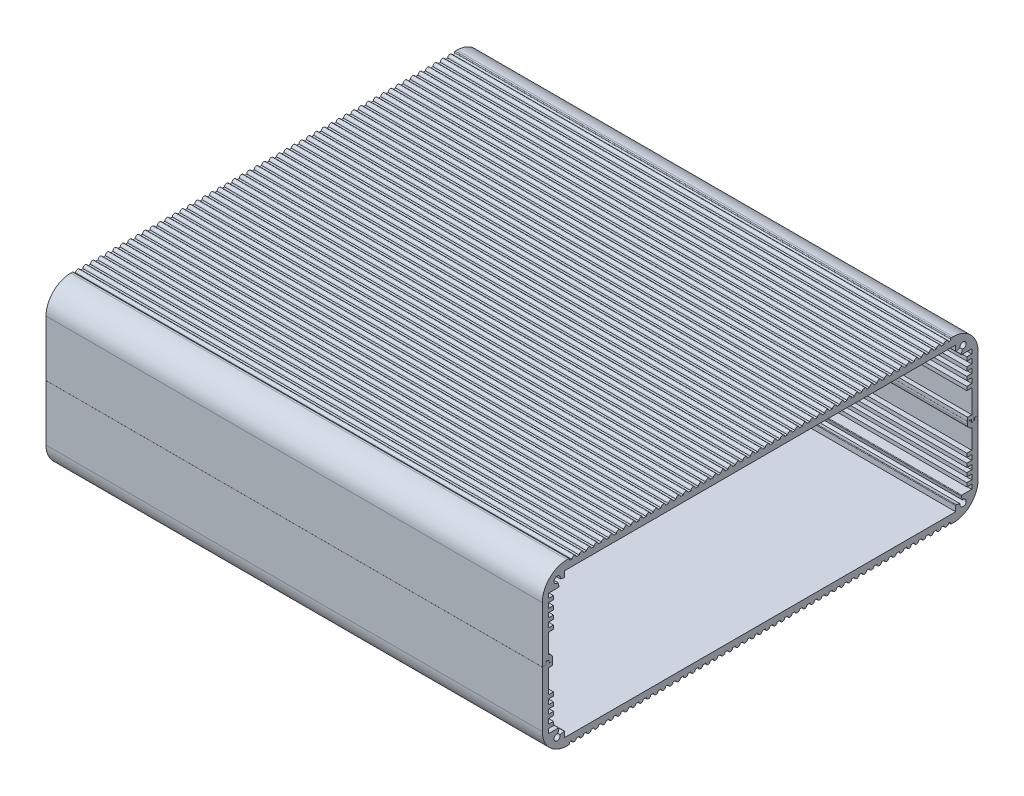
from build123d import *

# Parameters (mm, degrees)
EXTRUDE_1_DEPTH   = 100
EXTRUDE_1_2_DEPTH = 100


with BuildPart() as part:
    # 草图1 → 凸台-拉伸1 (new, symmetric)
    with BuildSketch(Plane(origin=(0, 0, 0), x_dir=(0, 0, -1), z_dir=(1, 0, 0))):
        with BuildLine():
            Line((-85.55, 1.21), (-85.85, 1.21))
            ThreePointArc((-85.85, 1.21), (-86.203553391, 1.063553391), (-86.35, 0.71))
            Line((-86.35, 0.71), (-86.35, 0.01))
            Line((-86.35, 0.01), (-87.8, 0.01))
            Line((-87.8, 0.01), (-87.8, 22.51))
            ThreePointArc((-87.8, 22.51), (-84.871067812, 29.581067812), (-77.8, 32.51))
            Line((-77.8, 32.51), (-77.1, 32.51))
            ThreePointArc((-77.1, 32.51), (-76.887867966, 32.422132034), (-76.8, 32.21))
            Line((-76.8, 32.21), (-76.8, 32.11))
            ThreePointArc((-76.8, 32.11), (-76.653553391, 31.756446609), (-76.3, 31.61))
            Line((-76.3, 31.61), (-75.9, 31.61))
            ThreePointArc((-75.9, 31.61), (-75, 32.51), (-74.1, 31.61))
            Line((-74.1, 31.61), (-72.9, 31.61))
            ThreePointArc((-72.9, 31.61), (-72, 32.51), (-71.1, 31.61))
            Line((-71.1, 31.61), (-69.9, 31.61))
            ThreePointArc((-69.9, 31.61), (-69, 32.51), (-68.1, 31.61))
            Line((-68.1, 31.61), (-66.9, 31.61))
            ThreePointArc((-66.9, 31.61), (-66, 32.51), (-65.1, 31.61))
            Line((-65.1, 31.61), (-63.9, 31.61))
            ThreePointArc((-63.9, 31.61), (-63, 32.51), (-62.1, 31.61))
            Line((-62.1, 31.61), (-60.9, 31.61))
            ThreePointArc((-60.9, 31.61), (-60, 32.51), (-59.1, 31.61))
            Line((-59.1, 31.61), (-57.9, 31.61))
            ThreePointArc((-57.9, 31.61), (-57, 32.51), (-56.1, 31.61))
            Line((-56.1, 31.61), (-54.9, 31.61))
            ThreePointArc((-54.9, 31.61), (-54, 32.51), (-53.1, 31.61))
            Line((-53.1, 31.61), (-51.9, 31.61))
            ThreePointArc((-51.9, 31.61), (-51, 32.51), (-50.1, 31.61))
            Line((-50.1, 31.61), (-48.9, 31.61))
            ThreePointArc((-48.9, 31.61), (-48, 32.51), (-47.1, 31.61))
            Line((-47.1, 31.61), (-45.9, 31.61))
            ThreePointArc((-45.9, 31.61), (-45, 32.51), (-44.1, 31.61))
            Line((-44.1, 31.61), (-42.9, 31.61))
            ThreePointArc((-42.9, 31.61), (-42, 32.51), (-41.1, 31.61))
            Line((-41.1, 31.61), (-39.9, 31.61))
            ThreePointArc((-39.9, 31.61), (-39, 32.51), (-38.1, 31.61))
            Line((-38.1, 31.61), (-36.9, 31.61))
            ThreePointArc((-36.9, 31.61), (-36, 32.51), (-35.1, 31.61))
            Line((-35.1, 31.61), (-33.9, 31.61))
            ThreePointArc((-33.9, 31.61), (-33, 32.51), (-32.1, 31.61))
            Line((-32.1, 31.61), (-30.9, 31.61))
            ThreePointArc((-30.9, 31.61), (-30, 32.51), (-29.1, 31.61))
            Line((-29.1, 31.61), (-27.9, 31.61))
            ThreePointArc((-27.9, 31.61), (-27, 32.51), (-26.1, 31.61))
            Line((-26.1, 31.61), (-24.9, 31.61))
            ThreePointArc((-24.9, 31.61), (-24, 32.51), (-23.1, 31.61))
            Line((-23.1, 31.61), (-21.9, 31.61))
            ThreePointArc((-21.9, 31.61), (-21, 32.51), (-20.1, 31.61))
            Line((-20.1, 31.61), (-18.9, 31.61))
            ThreePointArc((-18.9, 31.61), (-18, 32.51), (-17.1, 31.61))
            Line((-17.1, 31.61), (-15.9, 31.61))
            ThreePointArc((-15.9, 31.61), (-15, 32.51), (-14.1, 31.61))
            Line((-14.1, 31.61), (-12.9, 31.61))
            ThreePointArc((-12.9, 31.61), (-12, 32.51), (-11.1, 31.61))
            Line((-11.1, 31.61), (-9.9, 31.61))
            ThreePointArc((-9.9, 31.61), (-9, 32.51), (-8.1, 31.61))
            Line((-8.1, 31.61), (-6.9, 31.61))
            ThreePointArc((-6.9, 31.61), (-6, 32.51), (-5.1, 31.61))
            Line((-5.1, 31.61), (-3.9, 31.61))
            ThreePointArc((-3.9, 31.61), (-3, 32.51), (-2.1, 31.61))
            Line((-2.1, 31.61), (-0.9, 31.61))
            ThreePointArc((-0.9, 31.61), (0, 32.51), (0.9, 31.61))
            Line((0.9, 31.61), (2.1, 31.61))
            ThreePointArc((2.1, 31.61), (3, 32.51), (3.9, 31.61))
            Line((3.9, 31.61), (5.1, 31.61))
            ThreePointArc((5.1, 31.61), (6, 32.51), (6.9, 31.61))
            Line((6.9, 31.61), (8.1, 31.61))
            ThreePointArc((8.1, 31.61), (9, 32.51), (9.9, 31.61))
            Line((9.9, 31.61), (11.1, 31.61))
            ThreePointArc((11.1, 31.61), (12, 32.51), (12.9, 31.61))
            Line((12.9, 31.61), (14.1, 31.61))
            ThreePointArc((14.1, 31.61), (15, 32.51), (15.9, 31.61))
            Line((15.9, 31.61), (17.1, 31.61))
            ThreePointArc((17.1, 31.61), (18, 32.51), (18.9, 31.61))
            Line((18.9, 31.61), (20.1, 31.61))
            ThreePointArc((20.1, 31.61), (21, 32.51), (21.9, 31.61))
            Line((21.9, 31.61), (23.1, 31.61))
            ThreePointArc((23.1, 31.61), (24, 32.51), (24.9, 31.61))
            Line((24.9, 31.61), (26.1, 31.61))
            ThreePointArc((26.1, 31.61), (27, 32.51), (27.9, 31.61))
            Line((27.9, 31.61), (29.1, 31.61))
            ThreePointArc((29.1, 31.61), (30, 32.51), (30.9, 31.61))
            Line((30.9, 31.61), (32.1, 31.61))
            ThreePointArc((32.1, 31.61), (33, 32.51), (33.9, 31.61))
            Line((33.9, 31.61), (35.1, 31.61))
            ThreePointArc((35.1, 31.61), (36, 32.51), (36.9, 31.61))
            Line((36.9, 31.61), (38.1, 31.61))
            ThreePointArc((38.1, 31.61), (39, 32.51), (39.9, 31.61))
            Line((39.9, 31.61), (41.1, 31.61))
            ThreePointArc((41.1, 31.61), (42, 32.51), (42.9, 31.61))
            Line((42.9, 31.61), (44.1, 31.61))
            ThreePointArc((44.1, 31.61), (45, 32.51), (45.9, 31.61))
            Line((45.9, 31.61), (47.1, 31.61))
            ThreePointArc((47.1, 31.61), (48, 32.51), (48.9, 31.61))
            Line((48.9, 31.61), (50.1, 31.61))
            ThreePointArc((50.1, 31.61), (51, 32.51), (51.9, 31.61))
            Line((51.9, 31.61), (53.1, 31.61))
            ThreePointArc((53.1, 31.61), (54, 32.51), (54.9, 31.61))
            Line((54.9, 31.61), (56.1, 31.61))
            ThreePointArc((56.1, 31.61), (57, 32.51), (57.9, 31.61))
            Line((57.9, 31.61), (59.1, 31.61))
            ThreePointArc((59.1, 31.61), (60, 32.51), (60.9, 31.61))
            Line((60.9, 31.61), (62.1, 31.61))
            ThreePointArc((62.1, 31.61), (63, 32.51), (63.9, 31.61))
            Line((63.9, 31.61), (65.1, 31.61))
            ThreePointArc((65.1, 31.61), (66, 32.51), (66.9, 31.61))
            Line((66.9, 31.61), (68.1, 31.61))
            ThreePointArc((68.1, 31.61), (69, 32.51), (69.9, 31.61))
            Line((69.9, 31.61), (71.1, 31.61))
            ThreePointArc((71.1, 31.61), (72, 32.51), (72.9, 31.61))
            Line((72.9, 31.61), (74.1, 31.61))
            ThreePointArc((74.1, 31.61), (75, 32.51), (75.9, 31.61))
            Line((75.9, 31.61), (76.3, 31.61))
            ThreePointArc((76.3, 31.61), (76.653553391, 31.756446609), (76.8, 32.11))
            Line((76.8, 32.11), (76.8, 32.21))
            ThreePointArc((76.8, 32.21), (76.887867966, 32.422132034), (77.1, 32.51))
            Line((77.1, 32.51), (77.8, 32.51))
            ThreePointArc((77.8, 32.51), (84.871067812, 29.581067812), (87.8, 22.51))
            Line((87.8, 22.51), (87.8, 0.01))
            Line((87.8, 0.01), (86.25, 0.01))
            Line((86.25, 0.01), (86.25, -0.69))
            ThreePointArc((86.25, -0.69), (86.103553391, -1.043553391), (85.75, -1.19))
            Line((85.75, -1.19), (85.65, -1.19))
            ThreePointArc((85.65, -1.19), (85.296446609, -1.043553391), (85.15, -0.69))
            Line((85.15, -0.69), (85.15, 0.01))
            Line((85.15, 0.01), (83.6, 0.01))
            Line((83.6, 0.01), (83.6, 1.51))
            Line((83.6, 1.51), (85.3, 1.51))
            Line((85.3, 1.51), (85.3, 10.91))
            Line((85.3, 10.91), (83.3, 10.91))
            Line((83.3, 10.91), (83.3, 12.41))
            Line((83.3, 12.41), (85.3, 12.41))
            Line((85.3, 12.41), (85.3, 14.41))
            Line((85.3, 14.41), (83.3, 14.41))
            Line((83.3, 14.41), (83.3, 15.91))
            Line((83.3, 15.91), (85.3, 15.91))
            Line((85.3, 15.91), (85.3, 17.71))
            Line((85.3, 17.71), (83.3, 17.71))
            Line((83.3, 17.71), (83.3, 19.21))
            Line((83.3, 19.21), (85.3, 19.21))
            Line((85.3, 19.21), (85.3, 21.21))
            Line((85.3, 21.21), (83.3, 21.21))
            Line((83.3, 21.21), (83.3, 22.71))
            Line((83.3, 22.71), (85.3, 22.71))
            Line((85.3, 22.71), (85.3, 24.51))
            Line((85.3, 24.51), (81.256797497, 24.51))
            ThreePointArc((81.256797497, 24.51), (81.098126829, 24.588247714), (81.063612332, 24.761763809))
            Line((81.063612332, 24.761763809), (81.476476194, 26.302592717))
            ThreePointArc((81.476476194, 26.302592717), (82.683883476, 28.393883476), (80.592592717, 27.186476194))
            Line((80.592592717, 27.186476194), (79.051763809, 26.773612332))
            ThreePointArc((79.051763809, 26.773612332), (78.878247714, 26.808126829), (78.8, 26.966797497))
            Line((78.8, 26.966797497), (78.8, 29.11))
            Line((78.8, 29.11), (-78.8, 29.11))
            Line((-78.8, 29.11), (-78.8, 26.966797497))
            ThreePointArc((-78.8, 26.966797497), (-78.878247714, 26.808126829), (-79.051763809, 26.773612332))
            Line((-79.051763809, 26.773612332), (-80.592592717, 27.186476194))
            ThreePointArc((-80.592592717, 27.186476194), (-82.683883476, 28.393883476), (-81.476476194, 26.302592717))
            Line((-81.476476194, 26.302592717), (-81.063612332, 24.761763809))
            ThreePointArc((-81.063612332, 24.761763809), (-81.098126829, 24.588247714), (-81.256797497, 24.51))
            Line((-81.256797497, 24.51), (-85.3, 24.51))
            Line((-85.3, 24.51), (-85.3, 22.71))
            Line((-85.3, 22.71), (-83.3, 22.71))
            Line((-83.3, 22.71), (-83.3, 21.21))
            Line((-83.3, 21.21), (-85.3, 21.21))
            Line((-85.3, 21.21), (-85.3, 19.21))
            Line((-85.3, 19.21), (-83.3, 19.21))
            Line((-83.3, 19.21), (-83.3, 17.71))
            Line((-83.3, 17.71), (-85.3, 17.71))
            Line((-85.3, 17.71), (-85.3, 15.91))
            Line((-85.3, 15.91), (-83.3, 15.91))
            Line((-83.3, 15.91), (-83.3, 14.41))
            Line((-83.3, 14.41), (-85.3, 14.41))
            Line((-85.3, 14.41), (-85.3, 12.41))
            Line((-85.3, 12.41), (-83.3, 12.41))
            Line((-83.3, 12.41), (-83.3, 10.91))
            Line((-83.3, 10.91), (-85.3, 10.91))
            Line((-85.3, 10.91), (-85.3, 3.01))
            ThreePointArc((-85.3, 3.01), (-84.083424911, 2.336468488), (-83.6, 1.032628007))
            Line((-83.6, 1.032628007), (-83.6, 0.01))
            Line((-83.6, 0.01), (-85.05, 0.01))
            Line((-85.05, 0.01), (-85.05, 0.71))
            ThreePointArc((-85.05, 0.71), (-85.196446609, 1.063553391), (-85.55, 1.21))
        make_face()
    extrude(amount=EXTRUDE_1_DEPTH, both=True)


with BuildPart() as body_2:
    # 草图1 → Extrude 1 2 (new, symmetric)
    with BuildSketch(Plane(origin=(0, 0, 0), x_dir=(0, 0, -1), z_dir=(1, 0, 0))):
        with BuildLine():
            Line((85.55, -1.21), (85.85, -1.21))
            ThreePointArc((85.85, -1.21), (86.203553391, -1.063553391), (86.35, -0.71))
            Line((86.35, -0.71), (86.35, -0.01))
            Line((86.35, -0.01), (87.8, -0.01))
            Line((87.8, -0.01), (87.8, -22.51))
            ThreePointArc((87.8, -22.51), (84.871067812, -29.581067812), (77.8, -32.51))
            Line((77.8, -32.51), (77.1, -32.51))
            ThreePointArc((77.1, -32.51), (76.887867966, -32.422132034), (76.8, -32.21))
            Line((76.8, -32.21), (76.8, -32.11))
            ThreePointArc((76.8, -32.11), (76.653553391, -31.756446609), (76.3, -31.61))
            Line((76.3, -31.61), (75.9, -31.61))
            ThreePointArc((75.9, -31.61), (75, -32.51), (74.1, -31.61))
            Line((74.1, -31.61), (72.9, -31.61))
            ThreePointArc((72.9, -31.61), (72, -32.51), (71.1, -31.61))
            Line((71.1, -31.61), (69.9, -31.61))
            ThreePointArc((69.9, -31.61), (69, -32.51), (68.1, -31.61))
            Line((68.1, -31.61), (66.9, -31.61))
            ThreePointArc((66.9, -31.61), (66, -32.51), (65.1, -31.61))
            Line((65.1, -31.61), (63.9, -31.61))
            ThreePointArc((63.9, -31.61), (63, -32.51), (62.1, -31.61))
            Line((62.1, -31.61), (60.9, -31.61))
            ThreePointArc((60.9, -31.61), (60, -32.51), (59.1, -31.61))
            Line((59.1, -31.61), (57.9, -31.61))
            ThreePointArc((57.9, -31.61), (57, -32.51), (56.1, -31.61))
            Line((56.1, -31.61), (54.9, -31.61))
            ThreePointArc((54.9, -31.61), (54, -32.51), (53.1, -31.61))
            Line((53.1, -31.61), (51.9, -31.61))
            ThreePointArc((51.9, -31.61), (51, -32.51), (50.1, -31.61))
            Line((50.1, -31.61), (48.9, -31.61))
            ThreePointArc((48.9, -31.61), (48, -32.51), (47.1, -31.61))
            Line((47.1, -31.61), (45.9, -31.61))
            ThreePointArc((45.9, -31.61), (45, -32.51), (44.1, -31.61))
            Line((44.1, -31.61), (42.9, -31.61))
            ThreePointArc((42.9, -31.61), (42, -32.51), (41.1, -31.61))
            Line((41.1, -31.61), (39.9, -31.61))
            ThreePointArc((39.9, -31.61), (39, -32.51), (38.1, -31.61))
            Line((38.1, -31.61), (36.9, -31.61))
            ThreePointArc((36.9, -31.61), (36, -32.51), (35.1, -31.61))
            Line((35.1, -31.61), (33.9, -31.61))
            ThreePointArc((33.9, -31.61), (33, -32.51), (32.1, -31.61))
            Line((32.1, -31.61), (30.9, -31.61))
            ThreePointArc((30.9, -31.61), (30, -32.51), (29.1, -31.61))
            Line((29.1, -31.61), (27.9, -31.61))
            ThreePointArc((27.9, -31.61), (27, -32.51), (26.1, -31.61))
            Line((26.1, -31.61), (24.9, -31.61))
            ThreePointArc((24.9, -31.61), (24, -32.51), (23.1, -31.61))
            Line((23.1, -31.61), (21.9, -31.61))
            ThreePointArc((21.9, -31.61), (21, -32.51), (20.1, -31.61))
            Line((20.1, -31.61), (18.9, -31.61))
            ThreePointArc((18.9, -31.61), (18, -32.51), (17.1, -31.61))
            Line((17.1, -31.61), (15.9, -31.61))
            ThreePointArc((15.9, -31.61), (15, -32.51), (14.1, -31.61))
            Line((14.1, -31.61), (12.9, -31.61))
            ThreePointArc((12.9, -31.61), (12, -32.51), (11.1, -31.61))
            Line((11.1, -31.61), (9.9, -31.61))
            ThreePointArc((9.9, -31.61), (9, -32.51), (8.1, -31.61))
            Line((8.1, -31.61), (6.9, -31.61))
            ThreePointArc((6.9, -31.61), (6, -32.51), (5.1, -31.61))
            Line((5.1, -31.61), (3.9, -31.61))
            ThreePointArc((3.9, -31.61), (3, -32.51), (2.1, -31.61))
            Line((2.1, -31.61), (0.9, -31.61))
            ThreePointArc((0.9, -31.61), (0, -32.51), (-0.9, -31.61))
            Line((-0.9, -31.61), (-2.1, -31.61))
            ThreePointArc((-2.1, -31.61), (-3, -32.51), (-3.9, -31.61))
            Line((-3.9, -31.61), (-5.1, -31.61))
            ThreePointArc((-5.1, -31.61), (-6, -32.51), (-6.9, -31.61))
            Line((-6.9, -31.61), (-8.1, -31.61))
            ThreePointArc((-8.1, -31.61), (-9, -32.51), (-9.9, -31.61))
            Line((-9.9, -31.61), (-11.1, -31.61))
            ThreePointArc((-11.1, -31.61), (-12, -32.51), (-12.9, -31.61))
            Line((-12.9, -31.61), (-14.1, -31.61))
            ThreePointArc((-14.1, -31.61), (-15, -32.51), (-15.9, -31.61))
            Line((-15.9, -31.61), (-17.1, -31.61))
            ThreePointArc((-17.1, -31.61), (-18, -32.51), (-18.9, -31.61))
            Line((-18.9, -31.61), (-20.1, -31.61))
            ThreePointArc((-20.1, -31.61), (-21, -32.51), (-21.9, -31.61))
            Line((-21.9, -31.61), (-23.1, -31.61))
            ThreePointArc((-23.1, -31.61), (-24, -32.51), (-24.9, -31.61))
            Line((-24.9, -31.61), (-26.1, -31.61))
            ThreePointArc((-26.1, -31.61), (-27, -32.51), (-27.9, -31.61))
            Line((-27.9, -31.61), (-29.1, -31.61))
            ThreePointArc((-29.1, -31.61), (-30, -32.51), (-30.9, -31.61))
            Line((-30.9, -31.61), (-32.1, -31.61))
            ThreePointArc((-32.1, -31.61), (-33, -32.51), (-33.9, -31.61))
            Line((-33.9, -31.61), (-35.1, -31.61))
            ThreePointArc((-35.1, -31.61), (-36, -32.51), (-36.9, -31.61))
            Line((-36.9, -31.61), (-38.1, -31.61))
            ThreePointArc((-38.1, -31.61), (-39, -32.51), (-39.9, -31.61))
            Line((-39.9, -31.61), (-41.1, -31.61))
            ThreePointArc((-41.1, -31.61), (-42, -32.51), (-42.9, -31.61))
            Line((-42.9, -31.61), (-44.1, -31.61))
            ThreePointArc((-44.1, -31.61), (-45, -32.51), (-45.9, -31.61))
            Line((-45.9, -31.61), (-47.1, -31.61))
            ThreePointArc((-47.1, -31.61), (-48, -32.51), (-48.9, -31.61))
            Line((-48.9, -31.61), (-50.1, -31.61))
            ThreePointArc((-50.1, -31.61), (-51, -32.51), (-51.9, -31.61))
            Line((-51.9, -31.61), (-53.1, -31.61))
            ThreePointArc((-53.1, -31.61), (-54, -32.51), (-54.9, -31.61))
            Line((-54.9, -31.61), (-56.1, -31.61))
            ThreePointArc((-56.1, -31.61), (-57, -32.51), (-57.9, -31.61))
            Line((-57.9, -31.61), (-59.1, -31.61))
            ThreePointArc((-59.1, -31.61), (-60, -32.51), (-60.9, -31.61))
            Line((-60.9, -31.61), (-62.1, -31.61))
            ThreePointArc((-62.1, -31.61), (-63, -32.51), (-63.9, -31.61))
            Line((-63.9, -31.61), (-65.1, -31.61))
            ThreePointArc((-65.1, -31.61), (-66, -32.51), (-66.9, -31.61))
            Line((-66.9, -31.61), (-68.1, -31.61))
            ThreePointArc((-68.1, -31.61), (-69, -32.51), (-69.9, -31.61))
            Line((-69.9, -31.61), (-71.1, -31.61))
            ThreePointArc((-71.1, -31.61), (-72, -32.51), (-72.9, -31.61))
            Line((-72.9, -31.61), (-74.1, -31.61))
            ThreePointArc((-74.1, -31.61), (-75, -32.51), (-75.9, -31.61))
            Line((-75.9, -31.61), (-76.3, -31.61))
            ThreePointArc((-76.3, -31.61), (-76.653553391, -31.756446609), (-76.8, -32.11))
            Line((-76.8, -32.11), (-76.8, -32.21))
            ThreePointArc((-76.8, -32.21), (-76.887867966, -32.422132034), (-77.1, -32.51))
            Line((-77.1, -32.51), (-77.8, -32.51))
            ThreePointArc((-77.8, -32.51), (-84.871067812, -29.581067812), (-87.8, -22.51))
            Line((-87.8, -22.51), (-87.8, -0.01))
            Line((-87.8, -0.01), (-86.25, -0.01))
            Line((-86.25, -0.01), (-86.25, 0.69))
            ThreePointArc((-86.25, 0.69), (-86.103553391, 1.043553391), (-85.75, 1.19))
            Line((-85.75, 1.19), (-85.65, 1.19))
            ThreePointArc((-85.65, 1.19), (-85.296446609, 1.043553391), (-85.15, 0.69))
            Line((-85.15, 0.69), (-85.15, -0.01))
            Line((-85.15, -0.01), (-83.6, -0.01))
            Line((-83.6, -0.01), (-83.6, -1.51))
            Line((-83.6, -1.51), (-85.3, -1.51))
            Line((-85.3, -1.51), (-85.3, -10.91))
            Line((-85.3, -10.91), (-83.3, -10.91))
            Line((-83.3, -10.91), (-83.3, -12.41))
            Line((-83.3, -12.41), (-85.3, -12.41))
            Line((-85.3, -12.41), (-85.3, -14.41))
            Line((-85.3, -14.41), (-83.3, -14.41))
            Line((-83.3, -14.41), (-83.3, -15.91))
            Line((-83.3, -15.91), (-85.3, -15.91))
            Line((-85.3, -15.91), (-85.3, -17.71))
            Line((-85.3, -17.71), (-83.3, -17.71))
            Line((-83.3, -17.71), (-83.3, -19.21))
            Line((-83.3, -19.21), (-85.3, -19.21))
            Line((-85.3, -19.21), (-85.3, -21.21))
            Line((-85.3, -21.21), (-83.3, -21.21))
            Line((-83.3, -21.21), (-83.3, -22.71))
            Line((-83.3, -22.71), (-85.3, -22.71))
            Line((-85.3, -22.71), (-85.3, -24.51))
            Line((-85.3, -24.51), (-81.256797497, -24.51))
            ThreePointArc((-81.256797497, -24.51), (-81.098126829, -24.588247714), (-81.063612332, -24.761763809))
            Line((-81.063612332, -24.761763809), (-81.476476194, -26.302592717))
            ThreePointArc((-81.476476194, -26.302592717), (-82.683883476, -28.393883476), (-80.592592717, -27.186476194))
            Line((-80.592592717, -27.186476194), (-79.051763809, -26.773612332))
            ThreePointArc((-79.051763809, -26.773612332), (-78.878247714, -26.808126829), (-78.8, -26.966797497))
            Line((-78.8, -26.966797497), (-78.8, -29.11))
            Line((-78.8, -29.11), (78.8, -29.11))
            Line((78.8, -29.11), (78.8, -26.966797497))
            ThreePointArc((78.8, -26.966797497), (78.878247714, -26.808126829), (79.051763809, -26.773612332))
            Line((79.051763809, -26.773612332), (80.592592717, -27.186476194))
            ThreePointArc((80.592592717, -27.186476194), (82.683883476, -28.393883476), (81.476476194, -26.302592717))
            Line((81.476476194, -26.302592717), (81.063612332, -24.761763809))
            ThreePointArc((81.063612332, -24.761763809), (81.098126829, -24.588247714), (81.256797497, -24.51))
            Line((81.256797497, -24.51), (85.3, -24.51))
            Line((85.3, -24.51), (85.3, -22.71))
            Line((85.3, -22.71), (83.3, -22.71))
            Line((83.3, -22.71), (83.3, -21.21))
            Line((83.3, -21.21), (85.3, -21.21))
            Line((85.3, -21.21), (85.3, -19.21))
            Line((85.3, -19.21), (83.3, -19.21))
            Line((83.3, -19.21), (83.3, -17.71))
            Line((83.3, -17.71), (85.3, -17.71))
            Line((85.3, -17.71), (85.3, -15.91))
            Line((85.3, -15.91), (83.3, -15.91))
            Line((83.3, -15.91), (83.3, -14.41))
            Line((83.3, -14.41), (85.3, -14.41))
            Line((85.3, -14.41), (85.3, -12.41))
            Line((85.3, -12.41), (83.3, -12.41))
            Line((83.3, -12.41), (83.3, -10.91))
            Line((83.3, -10.91), (85.3, -10.91))
            Line((85.3, -10.91), (85.3, -3.01))
            ThreePointArc((85.3, -3.01), (84.083424911, -2.336468488), (83.6, -1.032628007))
            Line((83.6, -1.032628007), (83.6, -0.01))
            Line((83.6, -0.01), (85.05, -0.01))
            Line((85.05, -0.01), (85.05, -0.71))
            ThreePointArc((85.05, -0.71), (85.196446609, -1.063553391), (85.55, -1.21))
        make_face()
    extrude(amount=EXTRUDE_1_2_DEPTH, both=True)


solid = Compound([part.part, body_2.part])
